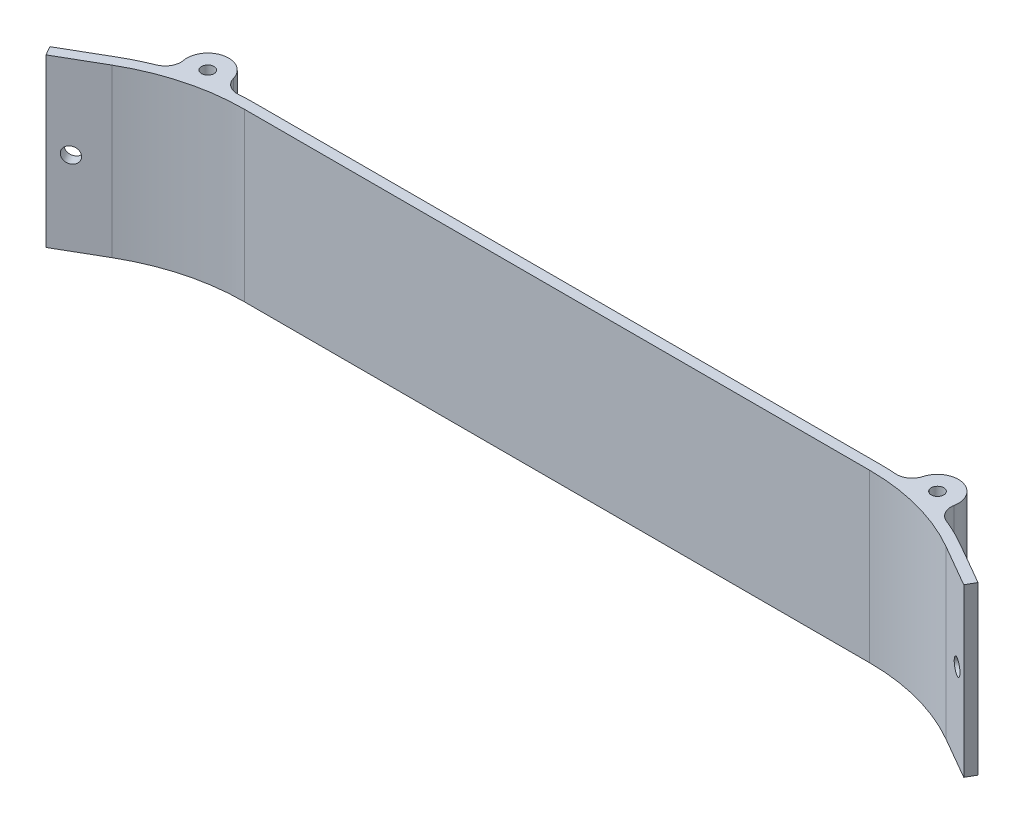
from build123d import *

# Parameters (mm, degrees)
EXTRU_MINCE1_DEPTH      = 32
ESQUISSE2_R             = 4
ESQUISSE2_R_2           = 1.2
BOSS_EXTRU_1_DEPTH      = 32
CONG_1_R                = 3
ESQUISSE3_R             = 1.5
ENL_V_MAT_EXTRU_1_DEPTH = 89.126236015


with BuildPart() as part:
    # Esquisse1 → Extru.-Mince1 (new body)
    with BuildSketch(Plane(origin=(0, 0, 0), x_dir=(1, 0, 0), z_dir=(0, 1, 0))):
        with BuildLine():
            Line((0, 0), (-60, 0))
            ThreePointArc((-60, 0), (-70.352761804, -1.362966948), (-80, -5.358983849))
            Line((-80, -5.358983849), (-88.038475773, -10))
            Line((-88.038475773, -10), (-89.038475773, -8.267949192))
            Line((-89.038475773, -8.267949192), (-81, -3.626933041))
            ThreePointArc((-81, -3.626933041), (-70.870399894, 0.568884704), (-60, 2))
            Line((-60, 2), (0, 2))
            Line((0, 2), (0, 0))
        make_face()
    extrude(amount=EXTRU_MINCE1_DEPTH)

    # Esquisse2 → Boss.-Extru.1 (add)
    with BuildSketch(Plane(origin=(0, 0, 0), x_dir=(1, 0, 0), z_dir=(0, 1, 0))):
        with Locations((-70, 3)):
            Circle(ESQUISSE2_R)
        with Locations(Location((-70, 3, 0), (0, 0, 270))):
            Circle(ESQUISSE2_R_2, mode=Mode.SUBTRACT)
    extrude(amount=BOSS_EXTRU_1_DEPTH)

    # Congé1
    cong_1_edges = [part.edges().sort_by_distance(p)[0] for p in [
        (-66.28080804, 16, -1.52771906),
        (-72.687893858, 16, -0.037699103),
    ]]
    fillet(cong_1_edges, radius=CONG_1_R)

    # Esquisse3 → Enlèv. mat.-Extru.1 (cut, through all)
    with BuildSketch(Plane(origin=(-17.679491924, 0, -30.621778265), x_dir=(0.8660254037844379, 0, -0.5000000000000014), z_dir=(0.5000000000000014, 0, 0.8660254037844379))):
        with Locations((-77.74355653, 16)):
            Circle(ESQUISSE3_R)
    extrude(amount=-ENL_V_MAT_EXTRU_1_DEPTH, mode=Mode.SUBTRACT)

    # Symétrie1: part across plane


with BuildPart() as part_1:
    add(part.part)
    add(part.part.mirror(Plane(origin=(0, 32, -2), x_dir=(0, 0, 1), z_dir=(1, 0, 0))))


solid = part_1.part
